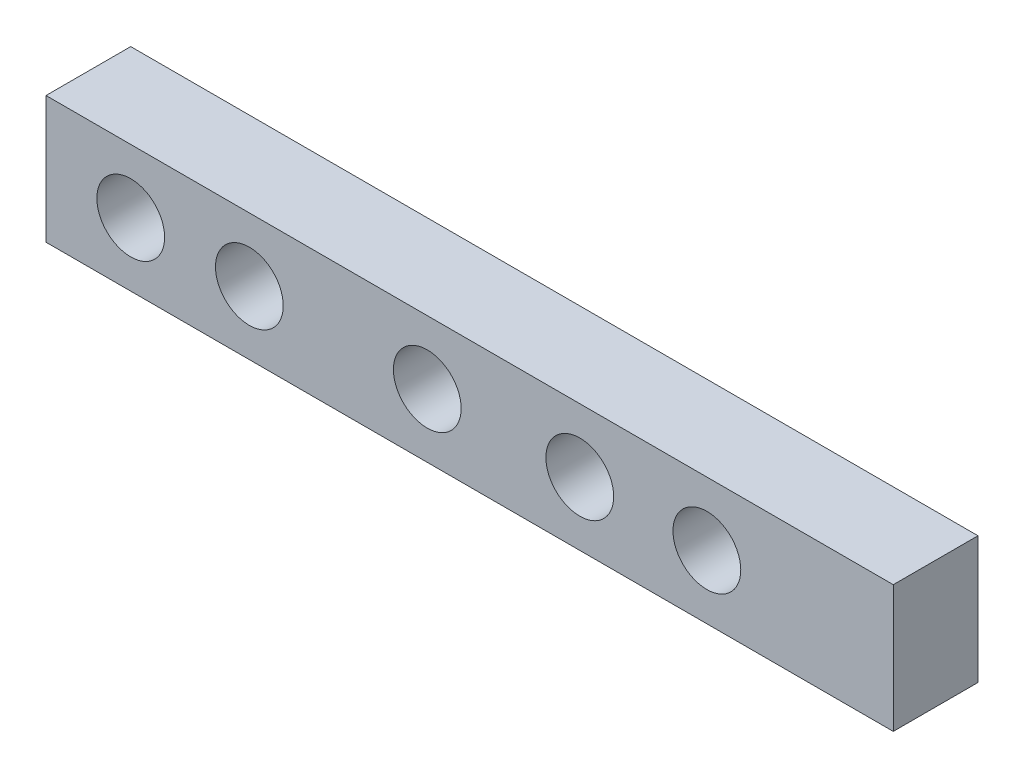
from build123d import *

# Parameters (mm, degrees)
SKETCH_1_W          = 100
SKETCH_1_H          = 15
EXTRUDE_1_DEPTH     = 10
SKETCH_4_R          = 4
CUT_EXTRUDE_3_DEPTH = 52.53882032


with BuildPart() as part:
    # Эскиз1 → Бобышка-Вытянуть1 (new body)
    with BuildSketch(Plane.XY):
        Rectangle(SKETCH_1_W, SKETCH_1_H)
    extrude(amount=EXTRUDE_1_DEPTH)

    # Эскиз4 → Вырез-Вытянуть3 (cut, through all)
    with BuildSketch(Plane.XY.offset(10)):
        with Locations((-40, 0)):
            Circle(SKETCH_4_R)
        with Locations((-26, 0)):
            Circle(SKETCH_4_R)
        with Locations((-5, 0)):
            Circle(SKETCH_4_R)
        with Locations((13, 0)):
            Circle(SKETCH_4_R)
        with Locations((28, 0)):
            Circle(SKETCH_4_R)
    extrude(amount=-CUT_EXTRUDE_3_DEPTH, mode=Mode.SUBTRACT)


solid = part.part
